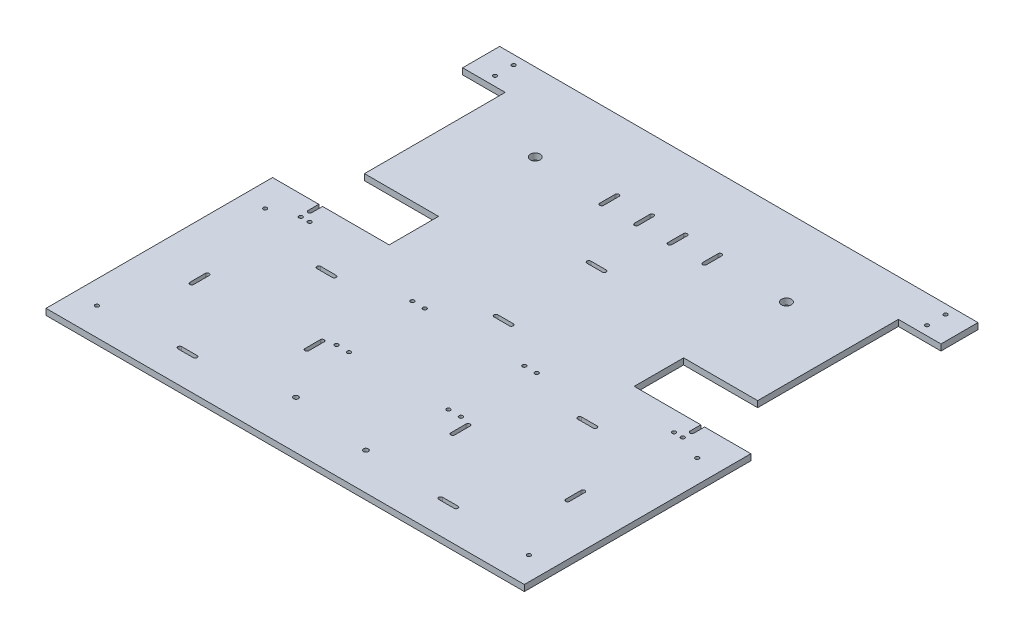
from build123d import *

# Parameters (mm, degrees)
SKETCH1_W           = 775
SKETCH1_H           = 735
BOSS_EXTRUDE1_DEPTH = 10
CUT_EXTRUDE1_DEPTH  = 10
SKETCH3_R           = 3.05
CUT_EXTRUDE2_DEPTH  = 10
CUT_EXTRUDE3_DEPTH  = 10
SKETCH5_R           = 4
CUT_EXTRUDE4_DEPTH  = 10
SKETCH6_R           = 3.05
CUT_EXTRUDE5_DEPTH  = 10
SKETCH7_R           = 8
CUT_EXTRUDE6_DEPTH  = 10


with BuildPart() as part:
    # Sketch1 → Boss-Extrude1 (new body)
    with BuildSketch(Plane(origin=(0, 0, 0), x_dir=(1, 0, 0), z_dir=(0, 1, 0))):
        Rectangle(SKETCH1_W, SKETCH1_H)
    extrude(amount=BOSS_EXTRUDE1_DEPTH)

    # Sketch2 → Cut-Extrude1 (cut)
    with BuildSketch(Plane(origin=(0, 10, 0), x_dir=(1, 0, 0), z_dir=(0, 1, 0))):
        Polygon((387.5, 307.5), (318.5, 307.5), (318.5, 79.5), (198.5, 79.5), (198.5, -0.5), (387.5, -0.5), align=None)
        Polygon((-387.5, -0.5), (-387.5, 307.5), (-318.5, 307.5), (-318.5, 79.5), (-198.5, 79.5), (-198.5, -0.5), align=None)
    extrude(amount=-CUT_EXTRUDE1_DEPTH, mode=Mode.SUBTRACT)

    # Sketch3 → Cut-Extrude2 (cut)
    with BuildSketch(Plane(origin=(0, 10, 0), x_dir=(1, 0, 0), z_dir=(0, 1, 0))):
        with Locations(Location((-350, 322.5, 0), (0, 0, 270))):
            Circle(SKETCH3_R)
        with Locations(Location((350, 322.5, 0), (0, 0, 90))):
            Circle(SKETCH3_R)
        with Locations(Location((350, -322.5, 0), (0, 0, 270))):
            Circle(SKETCH3_R)
        with Locations(Location((-350, -322.5, 0), (0, 0, 90))):
            Circle(SKETCH3_R)
        with Locations(Location((350, -50, 0), (0, 0, 90))):
            Circle(SKETCH3_R)
        with Locations(Location((-350, -50, 0), (0, 0, 270))):
            Circle(SKETCH3_R)
        with Locations(Location((-350, 352.5, 0), (0, 0, 270))):
            Circle(SKETCH3_R)
        with Locations(Location((350, 352.5, 0), (0, 0, 90))):
            Circle(SKETCH3_R)
    extrude(amount=-CUT_EXTRUDE2_DEPTH, mode=Mode.SUBTRACT)

    # Sketch4 → Cut-Extrude3 (cut)
    with BuildSketch(Plane(origin=(0, 10, 0), x_dir=(1, 0, 0), z_dir=(0, 1, 0))):
        with BuildLine():
            Line((-301.3, -214.3), (-301.3, -189.3))
            ThreePointArc((-301.3, -189.3), (-304.4, -186.2), (-307.5, -189.3))
            Line((-307.5, -189.3), (-307.5, -214.3))
            ThreePointArc((-307.5, -214.3), (-304.4, -217.4), (-301.3, -214.3))
        make_face()
        with BuildLine():
            Line((-223.8, -92.3), (-198.8, -92.3))
            ThreePointArc((-198.8, -92.3), (-195.7, -89.2), (-198.8, -86.1))
            Line((-198.8, -86.1), (-223.8, -86.1))
            ThreePointArc((-223.8, -86.1), (-226.9, -89.2), (-223.8, -92.3))
        make_face()
        with BuildLine():
            Line((-121.3, -189.3), (-121.3, -214.3))
            ThreePointArc((-121.3, -214.3), (-118.2, -217.4), (-115.1, -214.3))
            Line((-115.1, -214.3), (-115.1, -189.3))
            ThreePointArc((-115.1, -189.3), (-118.2, -186.2), (-121.3, -189.3))
        make_face()
        with BuildLine():
            Line((-198.8, -311.3), (-223.8, -311.3))
            ThreePointArc((-223.8, -311.3), (-226.9, -314.4), (-223.8, -317.5))
            Line((-223.8, -317.5), (-198.8, -317.5))
            ThreePointArc((-198.8, -317.5), (-195.7, -314.4), (-198.8, -311.3))
        make_face()
        with BuildLine():
            Line((198.8, -317.5), (223.8, -317.5))
            ThreePointArc((223.8, -317.5), (226.9, -314.4), (223.8, -311.3))
            Line((223.8, -311.3), (198.8, -311.3))
            ThreePointArc((198.8, -311.3), (195.7, -314.4), (198.8, -317.5))
        make_face()
        with BuildLine():
            Line((115.1, -189.3), (115.1, -214.3))
            ThreePointArc((115.1, -214.3), (118.2, -217.4), (121.3, -214.3))
            Line((121.3, -214.3), (121.3, -189.3))
            ThreePointArc((121.3, -189.3), (118.2, -186.2), (115.1, -189.3))
        make_face()
        with BuildLine():
            Line((223.8, -86.1), (198.8, -86.1))
            ThreePointArc((198.8, -86.1), (195.7, -89.2), (198.8, -92.3))
            Line((198.8, -92.3), (223.8, -92.3))
            ThreePointArc((223.8, -92.3), (226.9, -89.2), (223.8, -86.1))
        make_face()
        with BuildLine():
            Line((307.5, -214.3), (307.5, -189.3))
            ThreePointArc((307.5, -189.3), (304.4, -186.2), (301.3, -189.3))
            Line((301.3, -189.3), (301.3, -214.3))
            ThreePointArc((301.3, -214.3), (304.4, -217.4), (307.5, -214.3))
        make_face()
    extrude(amount=-CUT_EXTRUDE3_DEPTH, mode=Mode.SUBTRACT)

    # Sketch5 → Cut-Extrude4 (cut)
    with BuildSketch(Plane(origin=(0, 10, 0), x_dir=(1, 0, 0), z_dir=(0, 1, 0))):
        with Locations(Location((70.742847262, -307.5, 0), (0, 0, 270))):
            Circle(SKETCH5_R)
        with Locations(Location((-60.166013255, -290, 0), (0, 0, 270))):
            Circle(SKETCH5_R)
    extrude(amount=-CUT_EXTRUDE4_DEPTH, mode=Mode.SUBTRACT)

    # Sketch6 → Cut-Extrude5 (cut)
    with BuildSketch(Plane(origin=(0, 10, 0), x_dir=(1, 0, 0), z_dir=(0, 1, 0))):
        with Locations(Location((-100.729526925, -183.528276794, 0), (0, 0, 270))):
            Circle(SKETCH6_R)
        with Locations(Location((-80.603260731, -183.522806678, 0), (0, 0, 270))):
            Circle(SKETCH6_R)
        with Locations(Location((-100.762904784, -60.720718711, 0), (0, 0, 270))):
            Circle(SKETCH6_R)
        with Locations(Location((-80.636638589, -60.715248594, 0), (0, 0, 270))):
            Circle(SKETCH6_R)
        with Locations(Location((80.636638589, -60.715248594, 0), (0, 0, 90))):
            Circle(SKETCH6_R)
        with Locations(Location((100.762904784, -60.720718711, 0), (0, 0, 90))):
            Circle(SKETCH6_R)
        with Locations(Location((80.603260731, -183.522806678, 0), (0, 0, 90))):
            Circle(SKETCH6_R)
        with Locations(Location((100.729526925, -183.528276794, 0), (0, 0, 90))):
            Circle(SKETCH6_R)
        with Locations(Location((-309.45, -32.749027869, 0), (0, 0, 270))):
            Circle(SKETCH6_R)
        with Locations(Location((-295.213665555, -32.749027869, 0), (0, 0, 270))):
            Circle(SKETCH6_R)
        with Locations(Location((309.45, -32.749027869, 0), (0, 0, 90))):
            Circle(SKETCH6_R)
        with Locations(Location((295.213665555, -32.749027869, 0), (0, 0, 90))):
            Circle(SKETCH6_R)
        with BuildLine():
            Line((-312.5, -17.974833276), (-312.5, -0.5))
            ThreePointArc((-312.5, -0.5), (-309.45, 2.55), (-306.4, -0.5))
            Line((-306.4, -0.5), (-306.4, -17.974833276))
            ThreePointArc((-306.4, -17.974833276), (-309.45, -21.024833276), (-312.5, -17.974833276))
        make_face()
        with BuildLine():
            Line((312.5, -17.974833276), (312.5, -0.5))
            ThreePointArc((312.5, -0.5), (309.45, 2.55), (306.4, -0.5))
            Line((306.4, -0.5), (306.4, -17.974833276))
            ThreePointArc((306.4, -17.974833276), (309.45, -21.024833276), (312.5, -17.974833276))
        make_face()
    extrude(amount=-CUT_EXTRUDE5_DEPTH, mode=Mode.SUBTRACT)

    # Sketch7 → Cut-Extrude6 (cut)
    with BuildSketch(Plane(origin=(0, 10, 0), x_dir=(1, 0, 0), z_dir=(0, 1, 0))):
        with Locations(Location((-203.494386399, 241.114555962, 0), (0, 0, 270))):
            Circle(SKETCH7_R)
        with Locations(Location((203.494386399, 241.114555962, 0), (0, 0, 90))):
            Circle(SKETCH7_R)
        with BuildLine():
            Line((-12.5, -10.502549855), (12.5, -10.502549855))
            ThreePointArc((12.5, -10.502549855), (15.6, -13.602549855), (12.5, -16.702549855))
            Line((12.5, -16.702549855), (-12.5, -16.702549855))
            ThreePointArc((-12.5, -16.702549855), (-15.6, -13.602549855), (-12.5, -10.502549855))
        make_face()
        with BuildLine():
            Line((-12.5, 140.176827164), (12.5, 140.176827164))
            ThreePointArc((12.5, 140.176827164), (15.6, 137.076827164), (12.5, 133.976827164))
            Line((12.5, 133.976827164), (-12.5, 133.976827164))
            ThreePointArc((-12.5, 133.976827164), (-15.6, 137.076827164), (-12.5, 140.176827164))
        make_face()
        with BuildLine():
            Line((-24.016219384, 253.614555962), (-24.016219384, 228.614555962))
            ThreePointArc((-24.016219384, 228.614555962), (-27.116219384, 225.514555962), (-30.216219384, 228.614555962))
            Line((-30.216219384, 228.614555962), (-30.216219384, 253.614555962))
            ThreePointArc((-30.216219384, 253.614555962), (-27.116219384, 256.714555962), (-24.016219384, 253.614555962))
        make_face()
        with BuildLine():
            Line((-80.216219384, 253.614555962), (-80.216219384, 228.614555962))
            ThreePointArc((-80.216219384, 228.614555962), (-83.316219384, 225.514555962), (-86.416219384, 228.614555962))
            Line((-86.416219384, 228.614555962), (-86.416219384, 253.614555962))
            ThreePointArc((-86.416219384, 253.614555962), (-83.316219384, 256.714555962), (-80.216219384, 253.614555962))
        make_face()
        with BuildLine():
            Line((80.216219384, 253.614555962), (80.216219384, 228.614555962))
            ThreePointArc((80.216219384, 228.614555962), (83.316219384, 225.514555962), (86.416219384, 228.614555962))
            Line((86.416219384, 228.614555962), (86.416219384, 253.614555962))
            ThreePointArc((86.416219384, 253.614555962), (83.316219384, 256.714555962), (80.216219384, 253.614555962))
        make_face()
        with BuildLine():
            Line((24.016219384, 253.614555962), (24.016219384, 228.614555962))
            ThreePointArc((24.016219384, 228.614555962), (27.116219384, 225.514555962), (30.216219384, 228.614555962))
            Line((30.216219384, 228.614555962), (30.216219384, 253.614555962))
            ThreePointArc((30.216219384, 253.614555962), (27.116219384, 256.714555962), (24.016219384, 253.614555962))
        make_face()
    extrude(amount=-CUT_EXTRUDE6_DEPTH, mode=Mode.SUBTRACT)


solid = part.part
